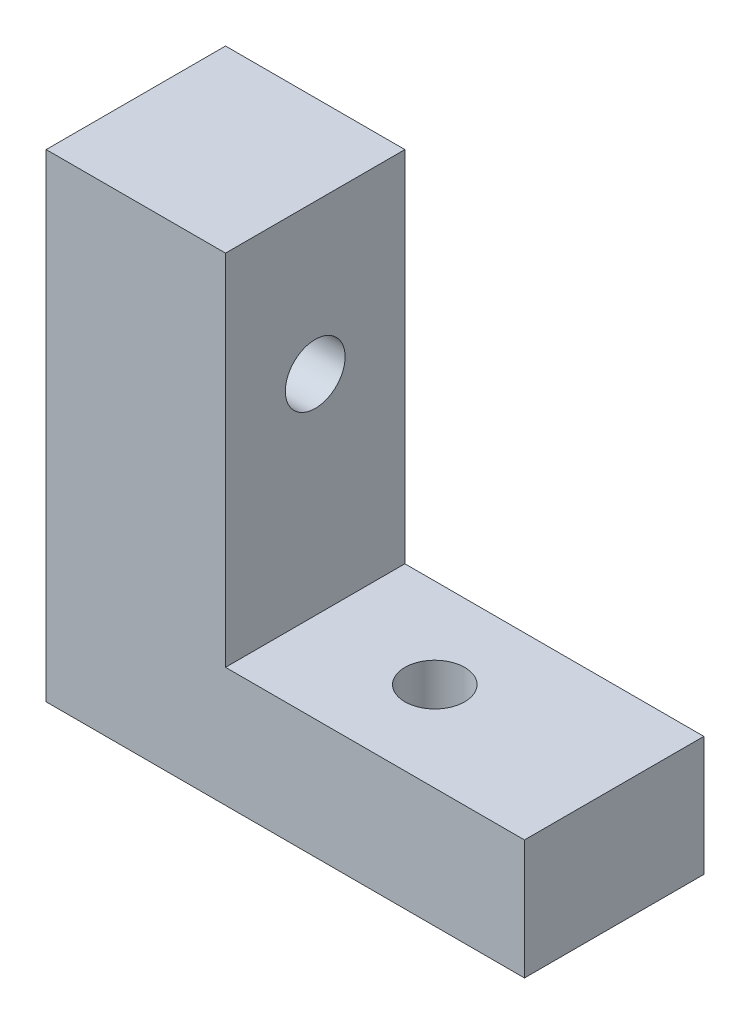
from build123d import *

# Parameters (mm, degrees)
BOSS_EXTRUDE1_DEPTH = 30
SKETCH2_R           = 5
CUT_EXTRUDE2_DEPTH  = 40
SKETCH4_R           = 5
CUT_EXTRUDE3_DEPTH  = 40


with BuildPart() as part:
    # Sketch1 → Boss-Extrude1 (new body)
    with BuildSketch(Plane.XY):
        Polygon((0, 0), (30, 0), (30, -60), (80, -60), (80, -80), (30, -80), (0, -80), align=None)
    extrude(amount=BOSS_EXTRUDE1_DEPTH)

    # Sketch2 → Cut-Extrude2 (cut)
    with BuildSketch(Plane(origin=(30, 0, 0), x_dir=(0, 0, -1), z_dir=(1, 0, 0))):
        with Locations((-15, -25)):
            Circle(SKETCH2_R)
    extrude(amount=-CUT_EXTRUDE2_DEPTH, mode=Mode.SUBTRACT)

    # Sketch4 → Cut-Extrude3 (cut)
    with BuildSketch(Plane(origin=(0, -60, 0), x_dir=(1, 0, 0), z_dir=(0, 1, 0))):
        with Locations(Location((50, -15, 0), (0, 0, 270))):
            Circle(SKETCH4_R)
    extrude(amount=-CUT_EXTRUDE3_DEPTH, mode=Mode.SUBTRACT)


solid = part.part
